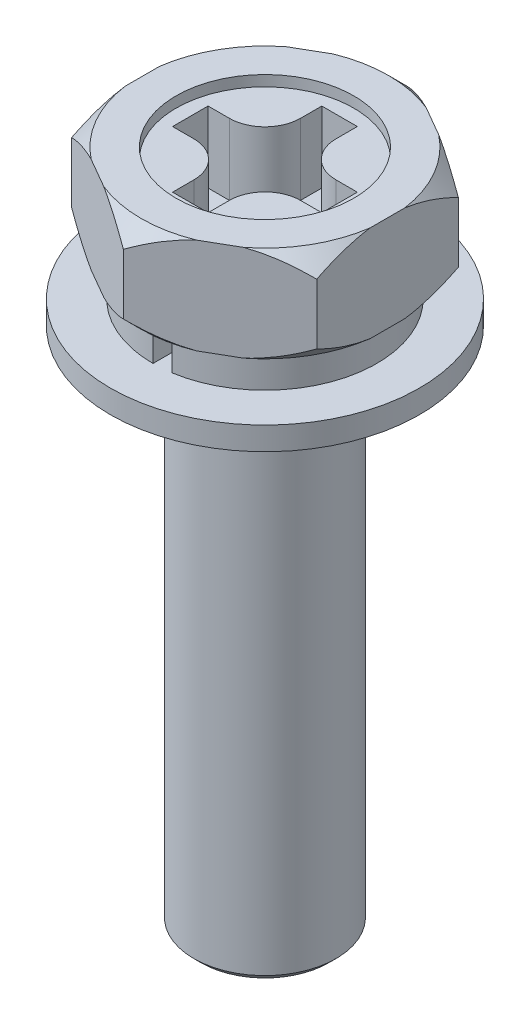
from build123d import *

# Parameters (mm, degrees)
BOSS_EXTRUDE1_DEPTH = 2.7
SKETCH3_R           = 2.5
CUT_EXTRUDE1_DEPTH  = 0.3
SKETCH4_R           = 2
BOSS_EXTRUDE2_DEPTH = 16.28
BOSS_EXTRUDE3_DEPTH = 1
SKETCH7_R           = 4.35
BOSS_EXTRUDE4_DEPTH = 0.65
SKETCH8_W           = 1
SKETCH8_H           = 1.6
SKETCH8_H_2         = 1
SKETCH8_W_2         = 1.6
CUT_EXTRUDE2_DEPTH  = 2
FILLET1_R           = 1
CHAMFER1_SIZE       = 0.2


with BuildPart() as part:
    # Sketch2 → Boss-Extrude1 (new body)
    with BuildSketch(Plane(origin=(0, 0, 0), x_dir=(1, 0, 0), z_dir=(0, 1, 0))):
        Polygon((0, -3.983716857), (3.45, -1.991858429), (3.45, 1.991858429), (0, 3.983716857), (-3.45, 1.991858429), (-3.45, -1.991858429), align=None)
    extrude(amount=BOSS_EXTRUDE1_DEPTH)

    # Sketch3 → Cut-Extrude1 (cut)
    with BuildSketch(Plane(origin=(0, 2.7, 0), x_dir=(1, 0, 0), z_dir=(0, 1, 0))):
        with Locations(Location((0, 0, 0), (0, 0, 270))):
            Circle(SKETCH3_R)
    extrude(amount=-CUT_EXTRUDE1_DEPTH, mode=Mode.SUBTRACT)

    # Sketch4 → Boss-Extrude2 (add)
    with BuildSketch(Plane.XZ):
        with Locations(Location((0, 0, 0), (0, 0, 270))):
            Circle(SKETCH4_R)
    extrude(amount=BOSS_EXTRUDE2_DEPTH)

    # Sketch5 → Boss-Extrude3 (add)
    with BuildSketch(Plane.XZ):
        with BuildLine():
            Line((0, 2.15), (0, 3.15))
            ThreePointArc((0, 3.15), (-0.250796162, -3.140000205), (0.5, 3.110064308))
            Line((0.5, 3.110064308), (0.5, 2.091052367))
            ThreePointArc((0.5, 2.091052367), (-0.251731416, -2.135212236), (0, 2.15))
        make_face()
    extrude(amount=BOSS_EXTRUDE3_DEPTH)

    # Sketch7 → Boss-Extrude4 (add)
    with BuildSketch(Plane.XZ.offset(1)):
        with Locations(Location((0, 0, 0), (0, 0, 270))):
            Circle(SKETCH7_R)
    extrude(amount=BOSS_EXTRUDE4_DEPTH)

    # Sketch8 → Cut-Extrude2 (cut)
    with BuildSketch(Plane(origin=(0, 2.4, 0), x_dir=(1, 0, 0), z_dir=(0, 1, 0))):
        with Locations((0, 1.3)):
            Rectangle(SKETCH8_W, SKETCH8_H)
        Rectangle(SKETCH8_W, SKETCH8_H_2)
        with Locations((-1.3, 0)):
            Rectangle(SKETCH8_W_2, SKETCH8_H_2)
        with Locations((0, -1.3)):
            Rectangle(SKETCH8_W, SKETCH8_H)
        with Locations((1.3, 0)):
            Rectangle(SKETCH8_W_2, SKETCH8_H_2)
    extrude(amount=-CUT_EXTRUDE2_DEPTH, mode=Mode.SUBTRACT)

    # Fillet1
    fillet1_edges = [part.edges().sort_by_distance(p)[0] for p in [
        (-0.5, 1.4, -0.5),
        (0.5, 1.4, -0.5),
        (0.5, 1.4, 0.5),
        (-0.5, 1.4, 0.5),
    ]]
    fillet(fillet1_edges, radius=FILLET1_R)

    # Sketch9 → Cut-Revolve1 (revolve, cut)
    with BuildSketch(Plane(origin=(0, 0, 0), x_dir=(0, 0, -1), z_dir=(1, 0, 0))):
        Polygon((-3.983716857, 2.7), (-3.483716857, 2.7), (-3.983716857, 2.2), align=None)
        Polygon((-3.983716857, 0.5), (-3.983716857, 0), (-3.483716857, 0), align=None)
    revolve(axis=Axis((0, 0, 0), (0, -1, 0)), mode=Mode.SUBTRACT)

    # Chamfer1
    chamfer1_edges = [part.edges().sort_by_distance(p)[0] for p in [
        (0, -16.28, 2),
    ]]
    chamfer(chamfer1_edges, length=CHAMFER1_SIZE)


solid = part.part
